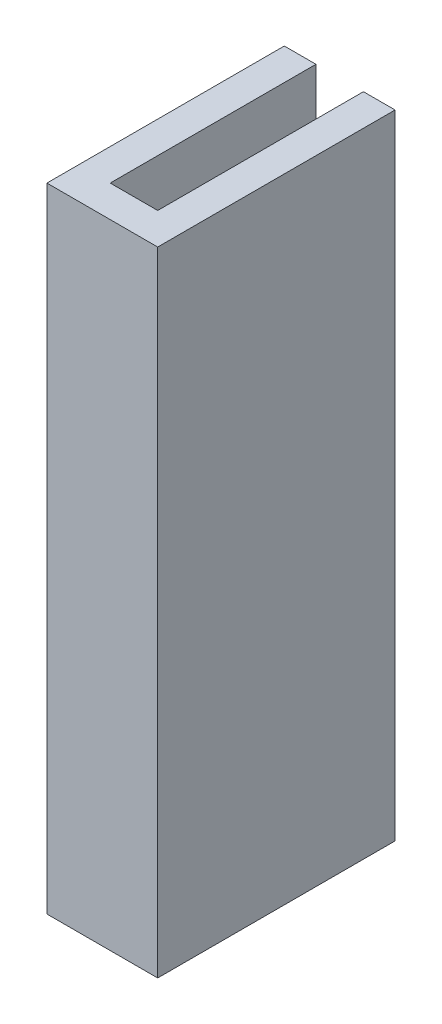
from build123d import *

# Parameters (mm, degrees)
BOSS_EXTRUDE1_DEPTH = 40
SKETCH3_W           = 5
SKETCH3_H           = 23
CUT_EXTRUDE1_DEPTH  = 13


with BuildPart() as part:
    # Sketch1 → Boss-Extrude1 (new body)
    with BuildSketch(Plane(origin=(0, 0, 0), x_dir=(1, 0, 0), z_dir=(0, 1, 0))):
        Polygon((-3.5, 15), (-3.5, 0), (3.5, 0), (3.5, 15), (1.5, 15), (1.5, 2), (-1.5, 2), (-1.5, 15), align=None)
    extrude(amount=BOSS_EXTRUDE1_DEPTH)

    # Sketch3 → Cut-Extrude1 (cut)
    with BuildSketch(Plane(origin=(0, 0, -15), x_dir=(-1, 0, 0), z_dir=(0, 0, -1))):
        with Locations((0, 20)):
            Rectangle(SKETCH3_W, SKETCH3_H)
    extrude(amount=-CUT_EXTRUDE1_DEPTH, mode=Mode.SUBTRACT)


solid = part.part
